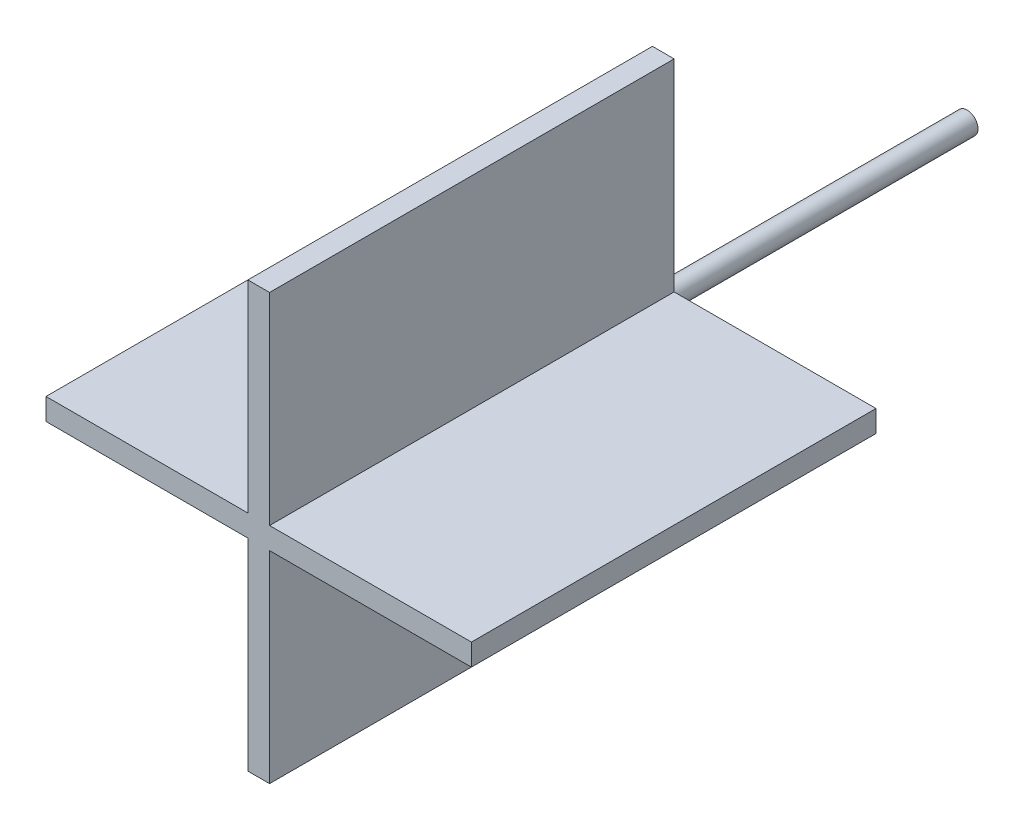
from build123d import *

# Parameters (mm, degrees)
P_IDAT_VYSUNUT_M1_DEPTH = 93.2
SKICA2_R                = 2.5
P_IDAT_VYSUNUT_M2_DEPTH = 70


with BuildPart() as part:
    # Skica1 → Přidat vysunutím1 (new body)
    with BuildSketch(Plane.XY):
        Polygon((0, 0), (-46.5, 0), (-46.5, 5), (0, 5), (0, 51.5), (5, 51.5), (5, 5), (51.5, 5), (51.5, 0), (5, 0), (5, -46.5), (0, -46.5), align=None)
    extrude(amount=P_IDAT_VYSUNUT_M1_DEPTH)

    # Skica2 → Přidat vysunutím2 (add)
    with BuildSketch(Plane.XY):
        with Locations((2.5, 2.536963061)):
            Circle(SKICA2_R)
    extrude(amount=-P_IDAT_VYSUNUT_M2_DEPTH)


solid = part.part
